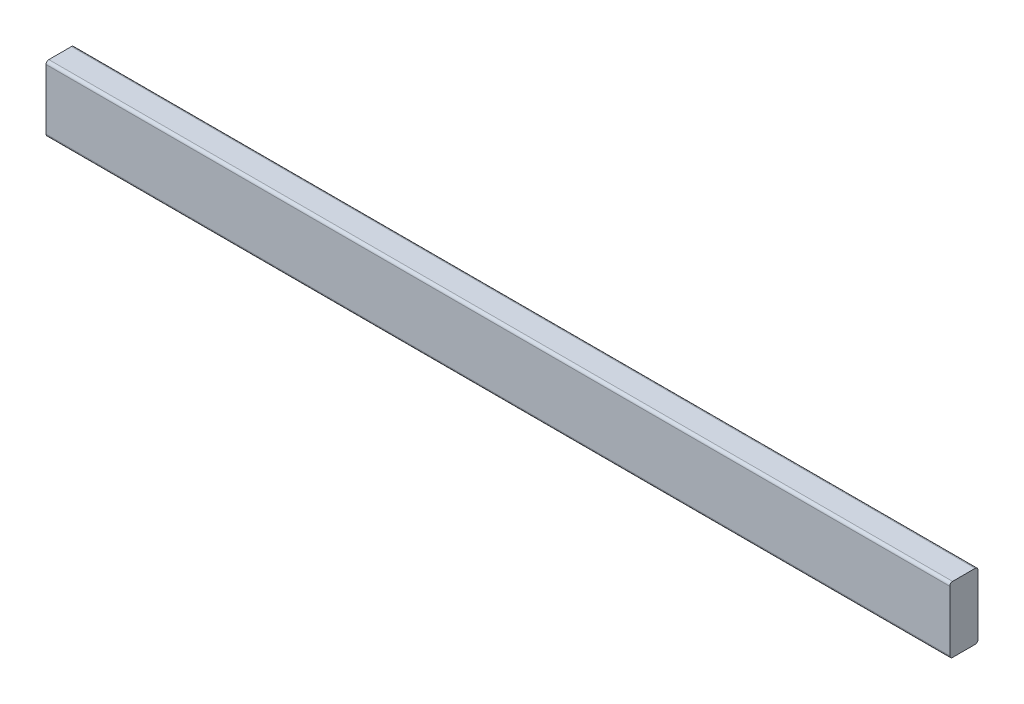
from build123d import *

# Parameters (mm, degrees)
BOSS_EXTRUDE1_DEPTH = 609.6


with BuildPart() as part:
    # Sketch1 → Boss-Extrude1 (new, symmetric)
    with BuildSketch(Plane(origin=(0, 0, 0), x_dir=(0, 0, -1), z_dir=(1, 0, 0))):
        with BuildLine():
            Line((-15.24, 44.45), (15.24, 44.45))
            ThreePointArc((15.24, 44.45), (17.934076836, 43.334076836), (19.05, 40.64))
            Line((19.05, 40.64), (19.05, -40.64))
            ThreePointArc((19.05, -40.64), (17.934076836, -43.334076836), (15.24, -44.45))
            Line((15.24, -44.45), (-15.24, -44.45))
            ThreePointArc((-15.24, -44.45), (-17.934076836, -43.334076836), (-19.05, -40.64))
            Line((-19.05, -40.64), (-19.05, 40.64))
            ThreePointArc((-19.05, 40.64), (-17.934076836, 43.334076836), (-15.24, 44.45))
        make_face()
    extrude(amount=BOSS_EXTRUDE1_DEPTH, both=True)


solid = part.part
